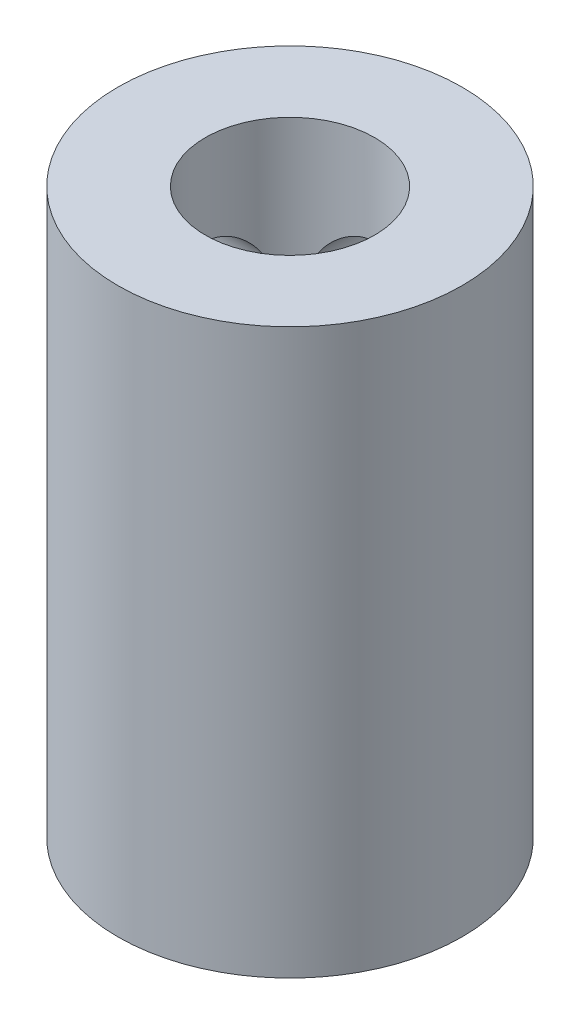
from build123d import *

# Parameters (mm, degrees)
CROQUIS1_R                            = 6.1
SALIENTE_EXTRUIR1_DEPTH               = 20
CROQUIS3_R                            = 3
CORTAR_EXTRUIR1_DEPTH                 = 22.781184541
CROQUIS5_W                            = 1.8
CROQUIS5_H                            = 6.1
TALADRO_DE_MARGEN_PARA_M31_AT_2_COUNT = 2
TALADRO_DE_MARGEN_PARA_M31_AT_2_PITCH = 10
CROQUIS7_W                            = 1.8
CROQUIS7_H                            = 6.1
TALADRO_DE_MARGEN_PARA_M32_AT_2_COUNT = 2
TALADRO_DE_MARGEN_PARA_M32_AT_2_PITCH = 10


with BuildPart() as part:
    # Croquis1 → Saliente-Extruir1 (new body)
    with BuildSketch(Plane(origin=(0, 0, 0), x_dir=(-1, 0, 0), z_dir=(0, 1, 0))):
        with Locations(Location((0, 0, 0), (0, 0, 90))):
            Circle(CROQUIS1_R)
    extrude(amount=SALIENTE_EXTRUIR1_DEPTH)

    # Croquis3 → Cortar-Extruir1 (cut, through all)
    with BuildSketch(Plane.XZ):
        with Locations(Location((0, 0, 0), (0, 0, 270))):
            Circle(CROQUIS3_R)
    extrude(amount=-CORTAR_EXTRUIR1_DEPTH, mode=Mode.SUBTRACT)

    # Croquis5 → Taladro de margen para M31 (revolve, cut)
    with BuildSketch(Plane(origin=(0, 15, 0), x_dir=(0, -1, 0), z_dir=(1, 0, 0))):
        with Locations((0.9, 3.05)):
            Rectangle(CROQUIS5_W, CROQUIS5_H)
    taladro_de_margen_para_m31 = revolve(axis=Axis((0, 15, 6.35), (0, 0, -1)), mode=Mode.SUBTRACT)

    # Taladro de margen para M31 at 2: Taladro de margen para M31 ×2
    with Locations(*[(0, -i * TALADRO_DE_MARGEN_PARA_M31_AT_2_PITCH, 0) for i in range(1, TALADRO_DE_MARGEN_PARA_M31_AT_2_COUNT)]):
        add(taladro_de_margen_para_m31, mode=Mode.SUBTRACT)

    # Croquis7 → Taladro de margen para M32 (revolve, cut)
    with BuildSketch(Plane(origin=(0, 5, 0), x_dir=(0, 0, -1), z_dir=(0, 1, 0))):
        with Locations((0.9, 3.05)):
            Rectangle(CROQUIS7_W, CROQUIS7_H)
    taladro_de_margen_para_m32 = revolve(axis=Axis((6.35, 5, 0), (-1, 0, 0)), mode=Mode.SUBTRACT)

    # Taladro de margen para M32 at 2: Taladro de margen para M32 ×2
    with Locations(*[(0, i * TALADRO_DE_MARGEN_PARA_M32_AT_2_PITCH, 0) for i in range(1, TALADRO_DE_MARGEN_PARA_M32_AT_2_COUNT)]):
        add(taladro_de_margen_para_m32, mode=Mode.SUBTRACT)


solid = part.part
